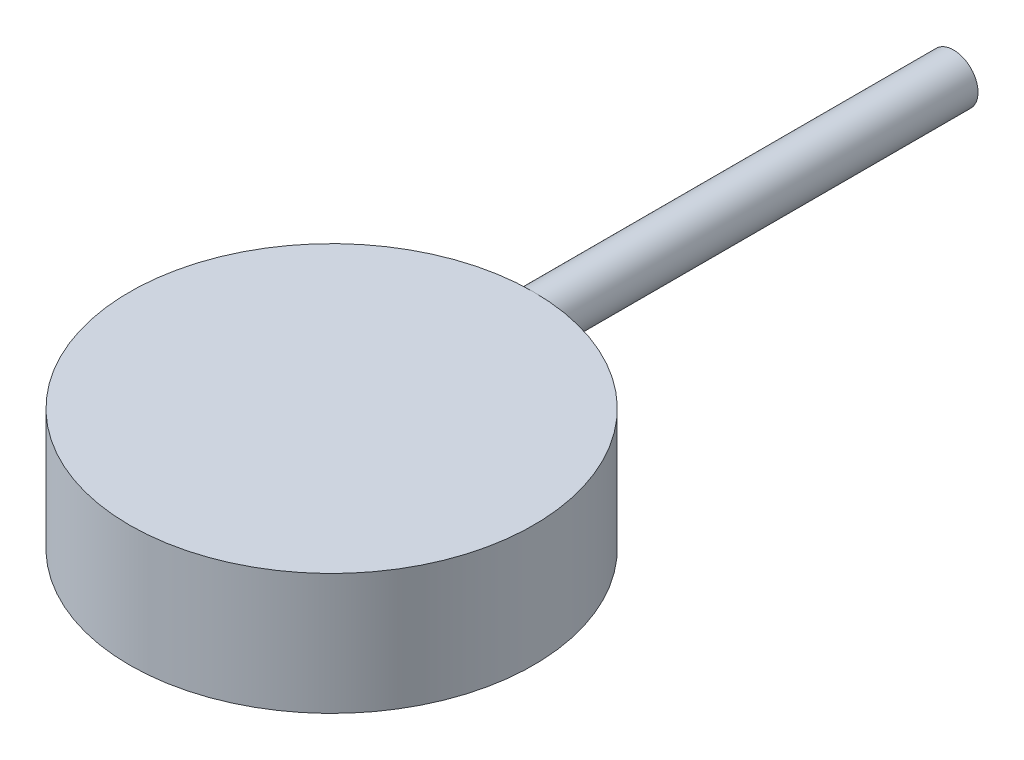
from build123d import *

# Parameters (mm, degrees)
BOSS_EXTRUDE1_DEPTH      = 5.08
BOSS_EXTRUDE1_DEPTH_BACK = 19.67000003
SKETCH1_R                = 41.25
SKETCH2_W                = 5
SKETCH2_H                = 127


with BuildPart() as part:
    # Sketch1 → Boss-Extrude1 (new, two sides: drawn at the far end of the back side and taken through both)
    with BuildSketch(Plane(origin=(0, 0, 0), x_dir=(1, 0, 0), z_dir=(0, 1, 0)).offset(-BOSS_EXTRUDE1_DEPTH_BACK)):
        with Locations(Location((0, 0, 0), (0, 0, 270))):
            Circle(SKETCH1_R)
    extrude(amount=BOSS_EXTRUDE1_DEPTH + BOSS_EXTRUDE1_DEPTH_BACK)

    # Sketch2 → Revolve1 (revolve)
    with BuildSketch(Plane(origin=(0, 0, 0), x_dir=(1, 0, 0), z_dir=(0, 1, 0))):
        with Locations((-2.5, 63.5)):
            Rectangle(SKETCH2_W, SKETCH2_H)
    revolve(axis=Axis((0, 0, -127), (0, 0, 1)))


solid = part.part
